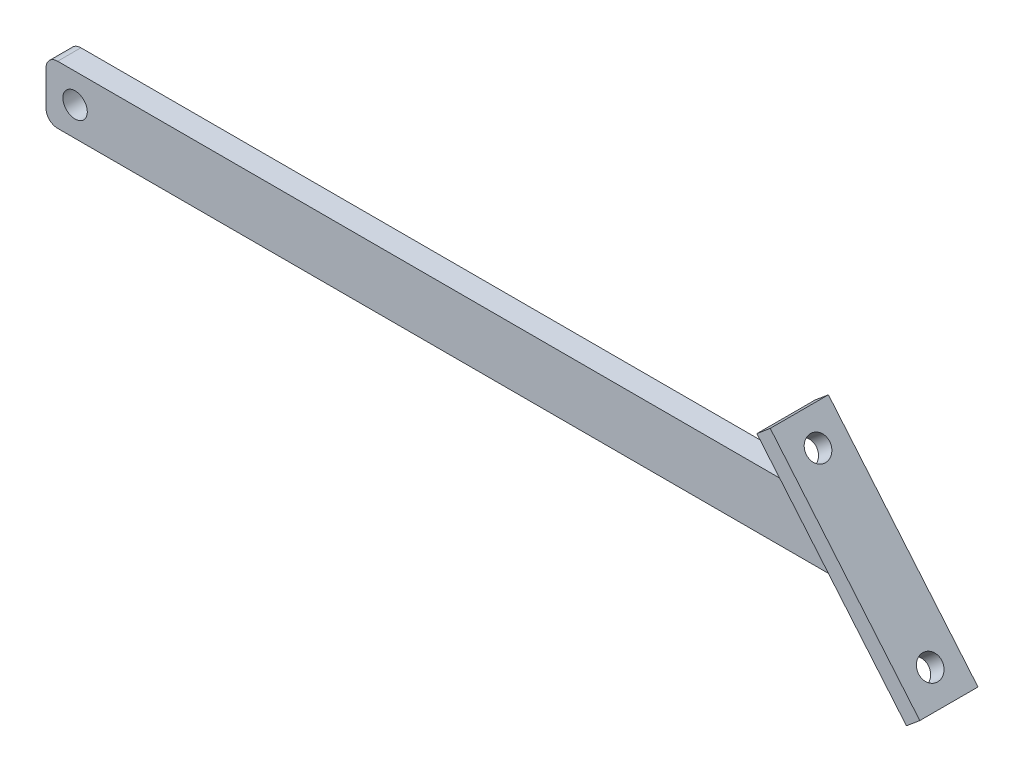
from build123d import *

# Parameters (mm, degrees)
SKETCH_1_R      = 2.1
EXTRUDE_1_DEPTH = 4
FILLET_1_R      = 2
SKETCH_2_R      = 2
EXTRUDE_2_DEPTH = 3


with BuildPart() as part:
    # 草图1 → 凸台-拉伸1 (new body)
    with BuildSketch(Plane.XY):
        Polygon((125.165745856, -4.723756906), (116.774749545, 5.276243094), (-14.834254144, 5.276243094), (-14.834254144, -4.723756906), align=None)
        with Locations((-9.834254144, 0.276243094)):
            Circle(SKETCH_1_R, mode=Mode.SUBTRACT)
    extrude(amount=EXTRUDE_1_DEPTH)

    # 圆角1
    fillet_1_edges = [part.edges().sort_by_distance(p)[0] for p in [
        (-14.834254144, 5.276243094, 2),
        (-14.834254144, -4.723756906, 2),
    ]]
    fillet(fillet_1_edges, radius=FILLET_1_R)

    # 草图2 → 凸台-拉伸2 (add)
    with BuildSketch(Plane(origin=(71.124278553, 59.680355902, 0), x_dir=(0, 0, -1), z_dir=(0.7660444431189745, 0.6427876096865437, 0))):
        Polygon((-4, -61.019525429), (3, -61.019525429), (3, -101.019525429), (-7, -101.019525429), (-7, -61.019525429), align=None)
        with Locations(Location((-2, -66.019525429, 0), (0, 0, 90))):
            Circle(SKETCH_2_R, mode=Mode.SUBTRACT)
        with Locations(Location((-2, -96.019525429, 0), (0, 0, 90))):
            Circle(SKETCH_2_R, mode=Mode.SUBTRACT)
    extrude(amount=EXTRUDE_2_DEPTH)


solid = part.part
